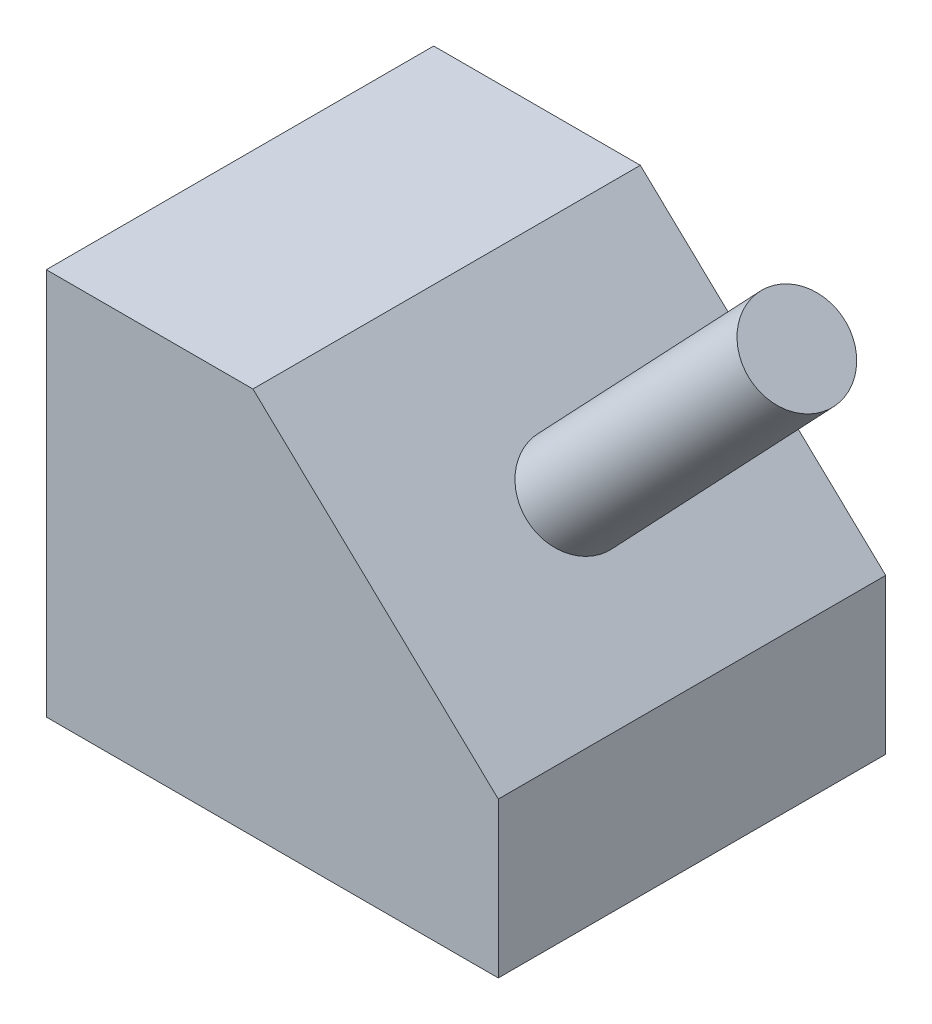
from build123d import *

# Parameters (mm, degrees)
EXTRUDE_1_DEPTH = 60
SKETCH_2_R      = 7.5
EXTRUDE_2_DEPTH = 50


with BuildPart() as part:
    # 草圖1 → 填料-伸長1 (new body)
    with BuildSketch(Plane.XY):
        Polygon((0, 0), (70, 0), (70, 24), (32, 60), (0, 60), align=None)
    extrude(amount=EXTRUDE_1_DEPTH)

    # 草圖2 → 填料-伸長2 (add)
    with BuildSketch(Plane(origin=(45.091970803, 47.597080292, 0), x_dir=(0.7259526839058265, -0.6877446479107832, 0), z_dir=(0.6877446479107832, 0.7259526839058265, 0))):
        with Locations(Location((9.310816324, -30, 0), (0, 0, 180))):
            Circle(SKETCH_2_R)
    extrude(amount=EXTRUDE_2_DEPTH)


solid = part.part
